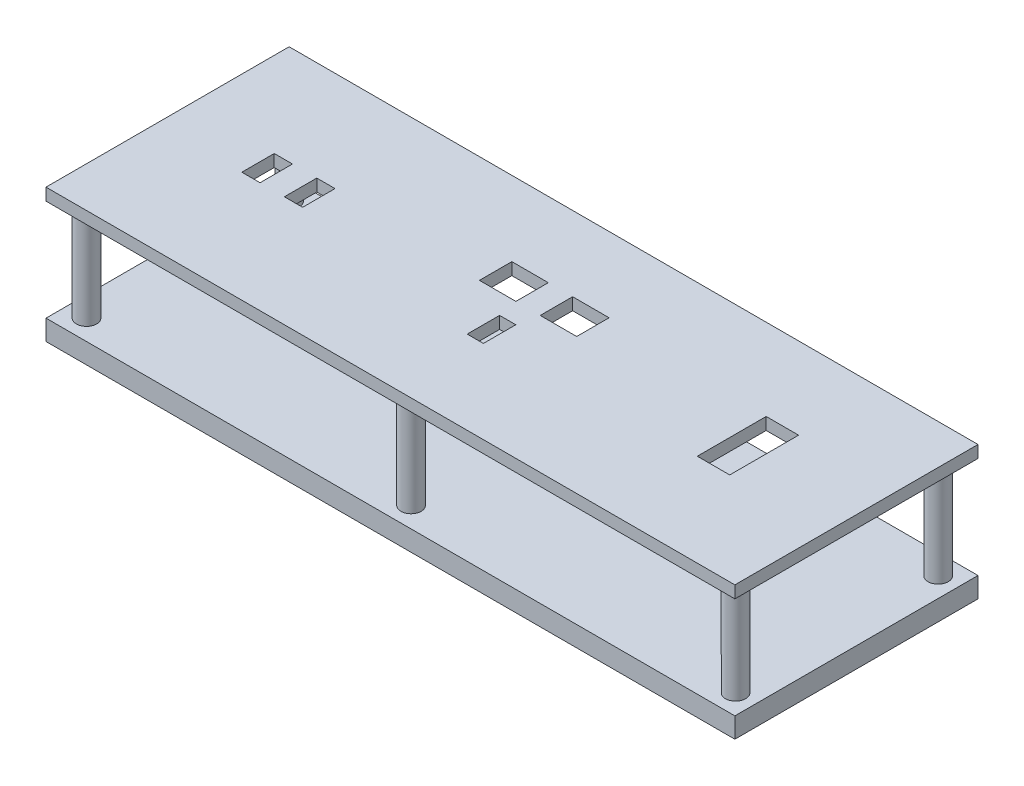
from build123d import *

# Parameters (mm, degrees)
SKETCH_1_W      = 170
SKETCH_1_H      = 60
SKETCH_1_W_2    = 4.5
SKETCH_1_H_2    = 8
SKETCH_1_W_3    = 8
SKETCH_1_H_3    = 17
SKETCH_1_W_4    = 4
SKETCH_1_W_5    = 9
EXTRUDE_1_DEPTH = 3
SKETCH_2_R      = 2.5
EXTRUDE_2_DEPTH = 25
SKETCH_3_W      = 170
SKETCH_3_H      = 60
EXTRUDE_3_DEPTH = 5


with BuildPart() as part:
    # 草图1 → 凸台-拉伸1 (new body)
    with BuildSketch(Plane(origin=(0, 0, 0), x_dir=(1, 0, 0), z_dir=(0, 1, 0))):
        with Locations((29.55216782, -0.710346801)):
            Rectangle(SKETCH_1_W, SKETCH_1_H)
        with Locations((-32.22272899, 0.64083336)):
            Rectangle(SKETCH_1_W_2, SKETCH_1_H_2, mode=Mode.SUBTRACT)
        with Locations((-21.72272899, 0.64083336)):
            Rectangle(SKETCH_1_W_2, SKETCH_1_H_2, mode=Mode.SUBTRACT)
        with Locations((86.428168623, 0.64083336)):
            Rectangle(SKETCH_1_W_3, SKETCH_1_H_3, mode=Mode.SUBTRACT)
        with Locations((29.933311746, -6.150891768)):
            Rectangle(SKETCH_1_W_4, SKETCH_1_H_2, mode=Mode.SUBTRACT)
        with Locations((22.455458099, 6.849108232)):
            Rectangle(SKETCH_1_W_5, SKETCH_1_H_2, mode=Mode.SUBTRACT)
        with Locations((37.455458099, 6.849108232)):
            Rectangle(SKETCH_1_W_5, SKETCH_1_H_2, mode=Mode.SUBTRACT)
    extrude(amount=EXTRUDE_1_DEPTH)

    # 草图2 → 凸台-拉伸2 (add)
    with BuildSketch(Plane.XZ):
        with Locations(Location((-50.44783218, 25.710346801, 0), (0, 0, 90))):
            Circle(SKETCH_2_R)
        with Locations(Location((-50.44783218, -24.289653199, 0), (0, 0, 90))):
            Circle(SKETCH_2_R)
        with Locations(Location((109.721085394, -24.289653199, 0), (0, 0, 90))):
            Circle(SKETCH_2_R)
        with Locations(Location((109.721085394, 25.710346801, 0), (0, 0, 90))):
            Circle(SKETCH_2_R)
        with Locations(Location((29.636626607, 25.710346801, 0), (0, 0, 90))):
            Circle(SKETCH_2_R)
        with Locations(Location((29.636626607, -24.289653199, 0), (0, 0, 90))):
            Circle(SKETCH_2_R)
    extrude(amount=EXTRUDE_2_DEPTH)

    # 草图3 → 凸台-拉伸3 (add)
    with BuildSketch(Plane.XZ.offset(25)):
        with Locations((29.55216782, 0.710346801)):
            Rectangle(SKETCH_3_W, SKETCH_3_H)
    extrude(amount=EXTRUDE_3_DEPTH)


solid = part.part
